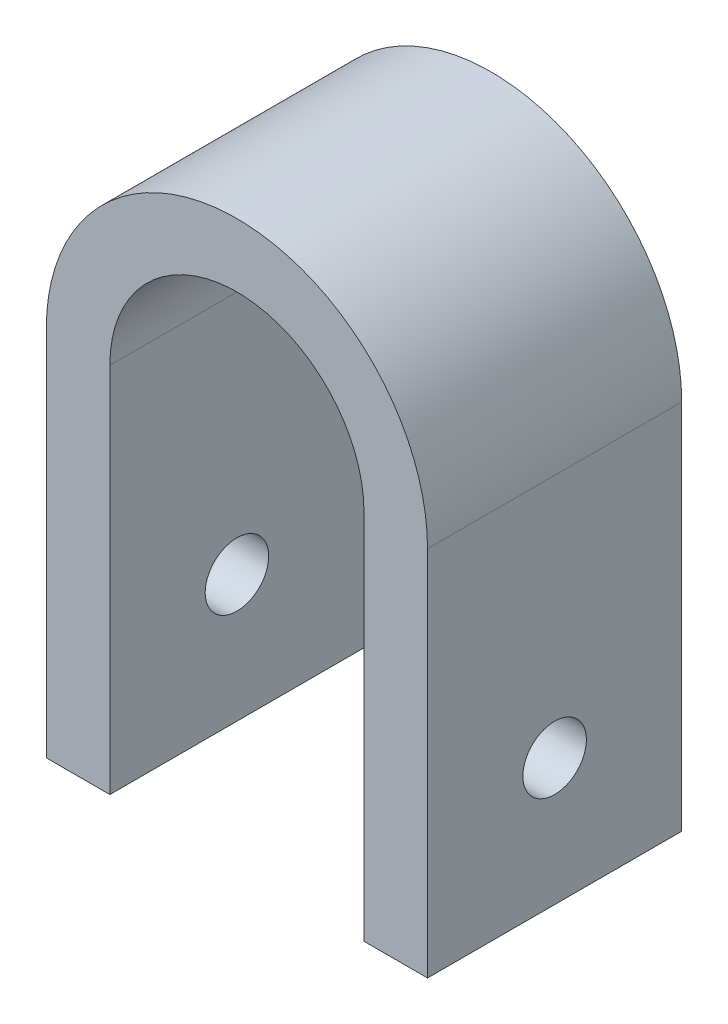
from build123d import *

# Parameters (mm, degrees)
BOSS_EXTRUDE1_DEPTH = 8
SKETCH2_R           = 1
CUT_EXTRUDE1_DEPTH  = 19.572175383


with BuildPart() as part:
    # Sketch1 → Boss-Extrude1 (new body)
    with BuildSketch(Plane.XY):
        with BuildLine():
            Line((-4, 0), (-4.000000001, -11.701525476))
            Line((-4.000000001, -11.701525476), (-6, -11.701525476))
            Line((-6, -11.701525476), (-6, 0))
            ThreePointArc((-6, 0), (0, 6), (6, 0))
            Line((6, 0), (6, -11.701525476))
            Line((6, -11.701525476), (3.999999999, -11.701525476))
            Line((3.999999999, -11.701525476), (4, 0))
            ThreePointArc((4, 0), (0, 4), (-4, 0))
        make_face()
    extrude(amount=BOSS_EXTRUDE1_DEPTH)

    # Sketch2 → Cut-Extrude1 (cut, through all)
    with BuildSketch(Plane.ZY.offset(6)):
        with Locations((4, -7.701525476)):
            Circle(SKETCH2_R)
    extrude(amount=-CUT_EXTRUDE1_DEPTH, mode=Mode.SUBTRACT)


solid = part.part
